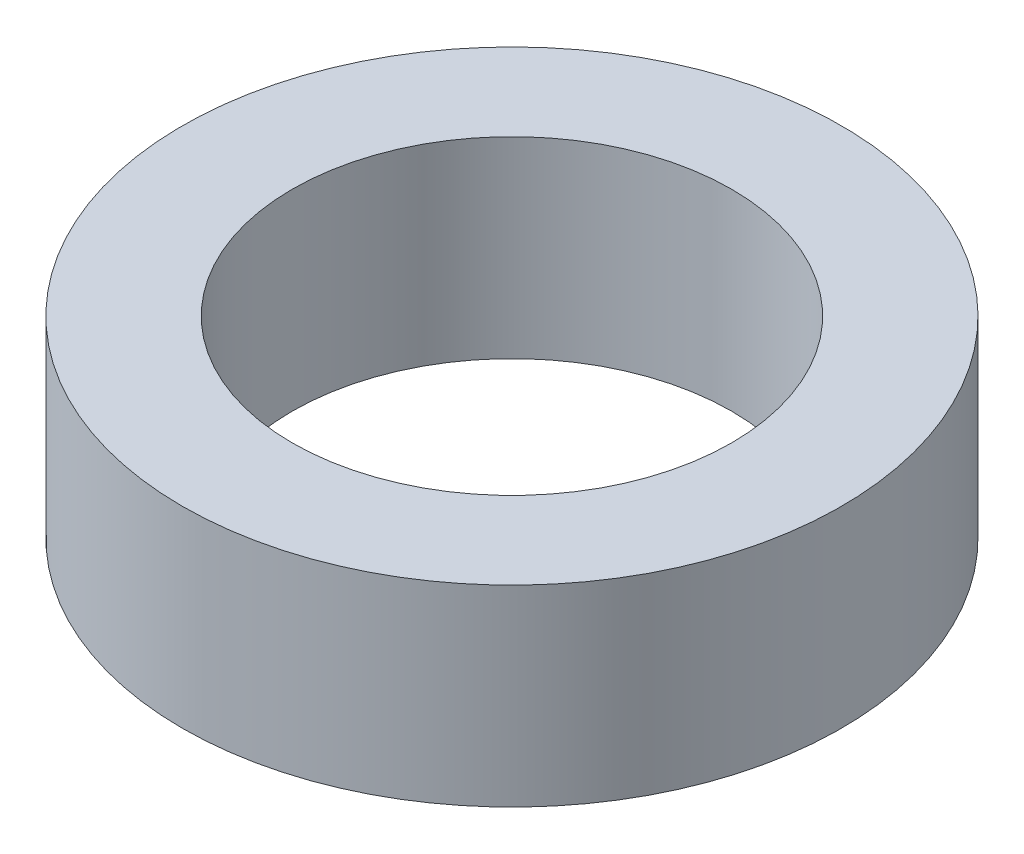
from build123d import *

# Parameters (mm, degrees)
SKETCH1_R           = 12
SKETCH1_R_2         = 8
BOSS_EXTRUDE1_DEPTH = 7


with BuildPart() as part:
    # Sketch1 → Boss-Extrude1 (new body)
    with BuildSketch(Plane(origin=(0, 0, 0), x_dir=(1, 0, 0), z_dir=(0, 1, 0))):
        with Locations(Location((0, 0, 0), (0, 0, 270))):
            Circle(SKETCH1_R)
        with Locations(Location((0, 0, 0), (0, 0, 270))):
            Circle(SKETCH1_R_2, mode=Mode.SUBTRACT)
    extrude(amount=BOSS_EXTRUDE1_DEPTH)


solid = part.part
